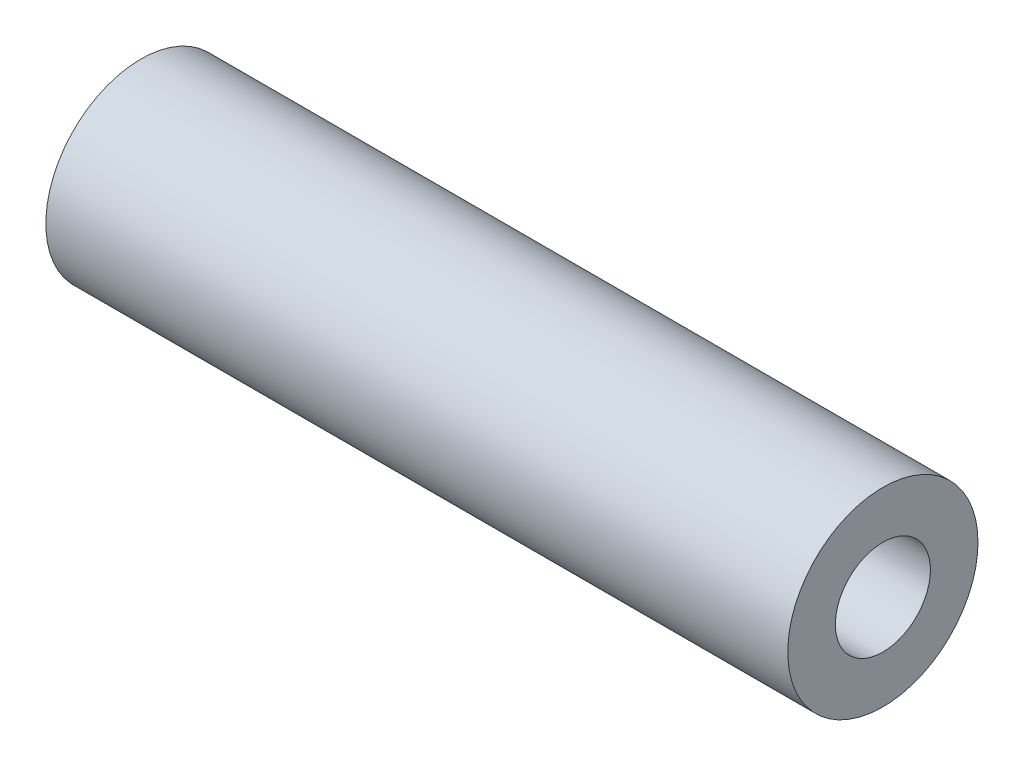
from build123d import *

# Parameters (mm, degrees)
CROQUIS1_R              = 5
CROQUIS1_R_2            = 2.5
SALIENTE_EXTRUIR1_DEPTH = 19.5


with BuildPart() as part:
    # Croquis1 → Saliente-Extruir1 (new, symmetric)
    with BuildSketch(Plane(origin=(0, 0, 0), x_dir=(0, 0, -1), z_dir=(1, 0, 0))):
        Circle(CROQUIS1_R)
        Circle(CROQUIS1_R_2, mode=Mode.SUBTRACT)
    extrude(amount=SALIENTE_EXTRUIR1_DEPTH, both=True)


solid = part.part
